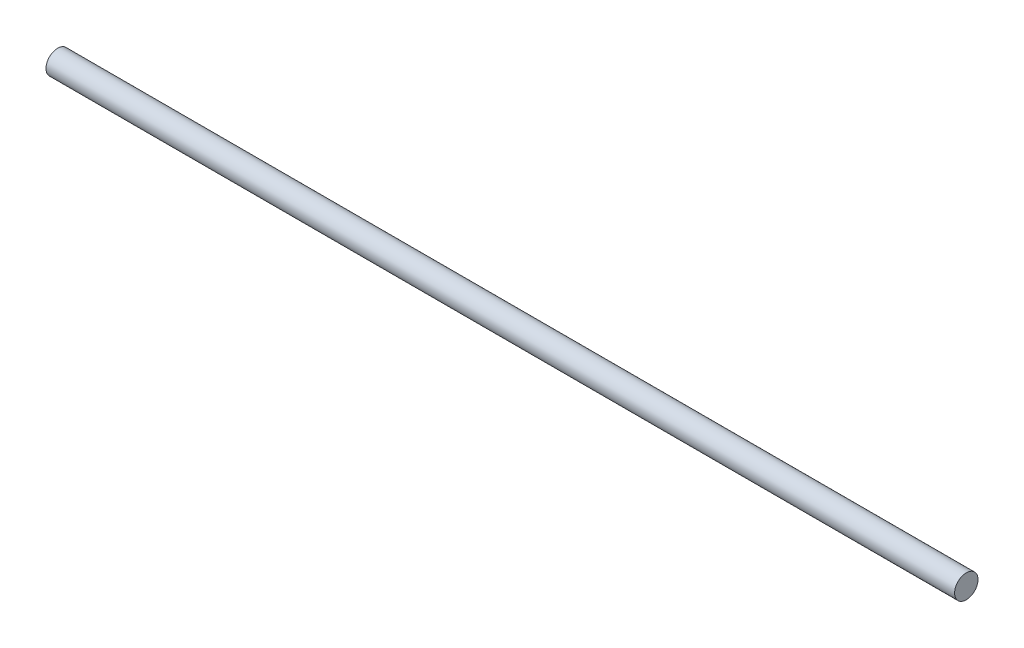
from build123d import *

# Parameters (mm, degrees)
SKETCH7_R = 2.5


with BuildPart() as part:
    # Sweep1: sweep along a path in Sketch1
    with BuildLine(Plane.XY) as sweep1_path:
        Line((4, 4), (198, 4))
    # Sketch7 → Sweep1 (sweep)
    with BuildSketch(Plane(origin=(198, 0, 0), x_dir=(0, 0, -1), z_dir=(1, 0, 0))):
        with Locations((0, 4)):
            Circle(SKETCH7_R)
    sweep(path=sweep1_path.line)


solid = part.part
